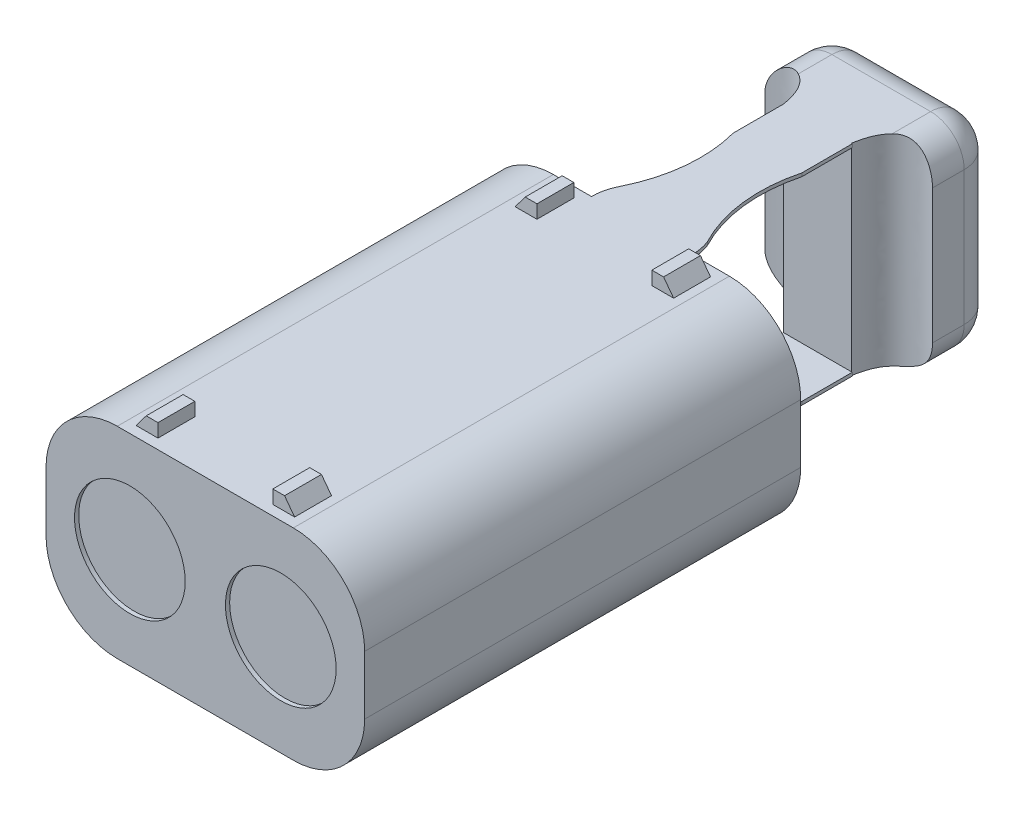
from build123d import *

# Parameters (mm, degrees)
SKETCH1_W               = 190
SKETCH1_H               = 120
BOSS_EXTRUDE1_DEPTH     = 260
FILLET1_R               = 42.5
SKETCH2_W               = 13
SKETCH2_H               = 22
BOSS_EXTRUDE2_DEPTH     = 8
CUT_EXTRUDE5_DEPTH      = 32
CUT_EXTRUDE6_DEPTH      = 32
BOSS_EXTRUDE3_DEPTH     = 2
SKETCH10_R              = 33
CUT_EXTRUDE7_DEPTH      = 2.5
MIRROR3_COPY_1_SKETCH_R = 33
MIRROR3_COPY_1_DEPTH    = 2.5
SKETCH11_W              = 98.911006982
SKETCH11_H              = 120
BOSS_EXTRUDE4_DEPTH     = 60
FILLET2_R               = 20
CUT_EXTRUDE8_REACH      = 465.953


with BuildPart() as part:
    # Sketch1 → Boss-Extrude1 (new body)
    with BuildSketch(Plane.XY):
        with Locations((40.07989685, -36.299360248)):
            Rectangle(SKETCH1_W, SKETCH1_H)
    extrude(amount=-BOSS_EXTRUDE1_DEPTH)

    # Fillet1
    fillet1_edges = [part.edges().sort_by_distance(p)[0] for p in [
        (-54.92010315, 23.700639752, -130),
        (135.07989685, 23.700639752, -130),
        (135.07989685, -96.299360248, -130),
        (-54.92010315, -96.299360248, -130),
    ]]
    fillet(fillet1_edges, radius=FILLET1_R)

    # Sketch2 → Boss-Extrude2 (add)
    with BuildSketch(Plane(origin=(0, 23.700639752, 0), x_dir=(1, 0, 0), z_dir=(0, 1, 0))):
        with Locations((-0.67010315, 243)):
            Rectangle(SKETCH2_W, SKETCH2_H)
        with Locations((80.82989685, 243)):
            Rectangle(SKETCH2_W, SKETCH2_H)
        with Locations((-0.67010315, 17)):
            Rectangle(SKETCH2_W, SKETCH2_H)
        with Locations((80.82989685, 17)):
            Rectangle(SKETCH2_W, SKETCH2_H)
    extrude(amount=BOSS_EXTRUDE2_DEPTH)

    # Sketch5 → Cut-Extrude5 (cut)
    with BuildSketch(Plane(origin=(0, 0, -254), x_dir=(-1, 0, 0), z_dir=(0, 0, -1))):
        Polygon((-87.32989685, 23.700639752), (-81.32989685, 31.700639752), (-87.32989685, 31.700639752), align=None)
    cut_extrude5 = extrude(amount=-CUT_EXTRUDE5_DEPTH, mode=Mode.SUBTRACT)

    # Sketch7 → Cut-Extrude6 (cut)
    with BuildSketch(Plane(origin=(0, 0, -254), x_dir=(-1, 0, 0), z_dir=(0, 0, -1))):
        Polygon((1.17010315, 31.700639752), (7.17010315, 23.700639752), (7.17010315, 31.700639752), align=None)
    cut_extrude6 = extrude(amount=-CUT_EXTRUDE6_DEPTH, mode=Mode.SUBTRACT)

    # Mirror1: Cut-Extrude5, Cut-Extrude6 across plane
    add(cut_extrude5.mirror(Plane.XY.offset(-130)), mode=Mode.SUBTRACT)
    add(cut_extrude6.mirror(Plane.XY.offset(-130)), mode=Mode.SUBTRACT)

    # Sketch9 → Boss-Extrude3 (add)
    with BuildSketch(Plane(origin=(0, 23.700639752, 0), x_dir=(1, 0, 0), z_dir=(0, 1, 0))):
        with BuildLine():
            ThreePointArc((13.944025684, 274.437502336), (11.227457344, 267.446426584), (10.32989685, 260))
            Line((10.32989685, 260), (10.32989685, 225))
            Line((10.32989685, 225), (20.57989685, 225))
            Line((20.57989685, 225), (61.829871341, 225))
            Line((61.829871341, 225), (70.32989685, 225))
            Line((70.32989685, 225), (70.32989685, 260))
            ThreePointArc((70.32989685, 260), (69.808755544, 265.731054618), (68.202935744, 271.257167))
            ThreePointArc((68.202935744, 271.257167), (58.544976128, 302.436051532), (60.82989685, 334.996428708))
            Line((60.82989685, 334.996428708), (60.82989685, 364.996428708))
            Line((60.82989685, 364.996428708), (19.82989685, 364.996428708))
            Line((19.82989685, 364.996428708), (19.82989685, 334.996428708))
            ThreePointArc((19.82989685, 334.996428708), (22.342438119, 304.186734294), (13.944025684, 274.437502336))
        make_face()
    boss_extrude3 = extrude(amount=-BOSS_EXTRUDE3_DEPTH)

    # Sketch10 → Cut-Extrude7 (cut, symmetric)
    with BuildSketch(Plane(origin=(0, 0, -260), x_dir=(-1, 0, 0), z_dir=(0, 0, -1))):
        with Locations((-85.07989685, -36.299360248)):
            Circle(SKETCH10_R)
    cut_extrude7 = extrude(amount=CUT_EXTRUDE7_DEPTH, both=True, mode=Mode.SUBTRACT)

    # Mirror2: Cut-Extrude7 across plane
    add(cut_extrude7.mirror(Plane(origin=(40.07989685, 0, 0), x_dir=(0, 0, 1), z_dir=(1, 0, 0))), mode=Mode.SUBTRACT)

    # Mirror3: Cut-Extrude7 across plane
    add(cut_extrude7.mirror(Plane.XY.offset(-130)), mode=Mode.SUBTRACT)

    # Mirror3 copy 1 sketch → Mirror3 copy 1 (cut, symmetric)
    with BuildSketch(Plane(origin=(80.1597937, 0, 0), x_dir=(1, 0, 0), z_dir=(0, 0, 1))):
        with Locations((-85.07989685, -36.299360248)):
            Circle(MIRROR3_COPY_1_SKETCH_R)
    extrude(amount=MIRROR3_COPY_1_DEPTH, both=True, mode=Mode.SUBTRACT)

    # Mirror4: Boss-Extrude3 across plane
    add(boss_extrude3.mirror(Plane.ZX.offset(-36.299360248)))

    # Sketch11 → Boss-Extrude4 (add)
    with BuildSketch(Plane(origin=(0, 0, -364.996428708), x_dir=(-1, 0, 0), z_dir=(0, 0, -1))):
        with Locations((-38.121760163, -36.299360248)):
            Rectangle(SKETCH11_W, SKETCH11_H)
    extrude(amount=BOSS_EXTRUDE4_DEPTH)

    # Fillet2
    fillet2_edges = [part.edges().sort_by_distance(p)[0] for p in [
        (87.577263654, 23.700639752, -394.996428708),
        (87.577263654, -96.299360248, -394.996428708),
        (-11.333743328, -96.299360248, -394.996428708),
        (-11.333743328, 23.700639752, -394.996428708),
        (87.577263654, -36.299360248, -424.996428708),
        (38.121760163, -96.299360248, -424.996428708),
        (-11.333743328, -36.299360248, -424.996428708),
        (38.121760163, 23.700639752, -424.996428708),
    ]]
    fillet(fillet2_edges, radius=FILLET2_R)

    # Sketch12 → Cut-Extrude8 (cut, up to next)
    with BuildSketch(Plane.XZ.offset(96.299360248), mode=Mode.PRIVATE) as cut_extrude8_sk1:
        with BuildLine():
            Line((-11.333743328, -384.996428708), (-11.333743328, -364.996428708))
            Line((-11.333743328, -364.996428708), (19.82989685, -364.996428708))
            add(Edge.make_bspline(
                [(-11.333743328, -384.996428708), (15.244679544, -393.728247891), (19.82989685, -364.996428708)],
                knots=[0, 0, 0, 1, 1, 1], degree=2))
        make_face()
    cut_extrude8_tool1 = extrude(cut_extrude8_sk1.sketch, amount=-CUT_EXTRUDE8_REACH, mode=Mode.PRIVATE) & part.part
    cut_extrude8 = cut_extrude8_tool1.solids().sort_by_distance((2.471753, -96.29936, -374.935763))[0]
    add(cut_extrude8, mode=Mode.SUBTRACT)

    # Mirror5: Cut-Extrude8 across plane
    add(cut_extrude8.mirror(Plane(origin=(40.07989685, 0, 0), x_dir=(0, 0, 1), z_dir=(1, 0, 0))), mode=Mode.SUBTRACT)


solid = part.part
